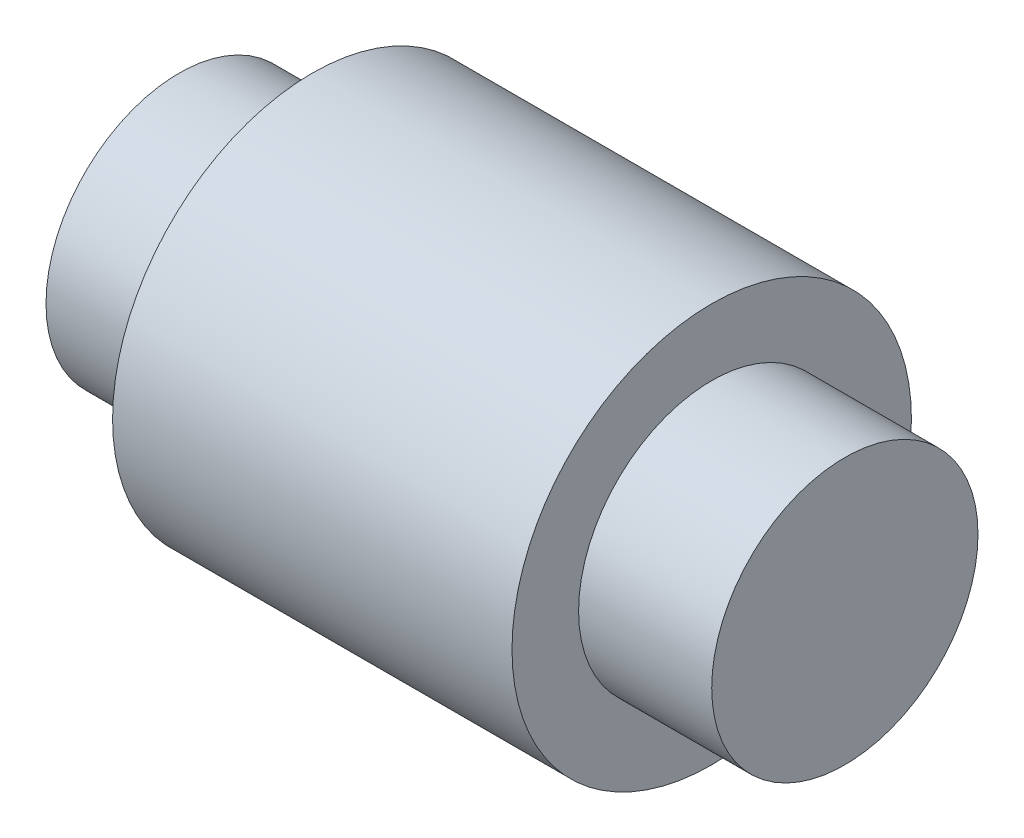
from build123d import *


with BuildPart() as part:
    # Эскиз1 → Повернуть1 (revolve)
    with BuildSketch(Plane.XY, mode=Mode.PRIVATE) as revolve_1_sk:
        Polygon((0, 0), (100, 0), (100, 20), (80, 20), (80, 30), (20, 30), (20, 20), (0, 20), align=None)
    revolve(revolve_1_sk.sketch.rotate(Axis((0, 0, 0), (1, 0, 0)), 90), axis=Axis((0, 0, 0), (1, 0, 0)))


solid = part.part
